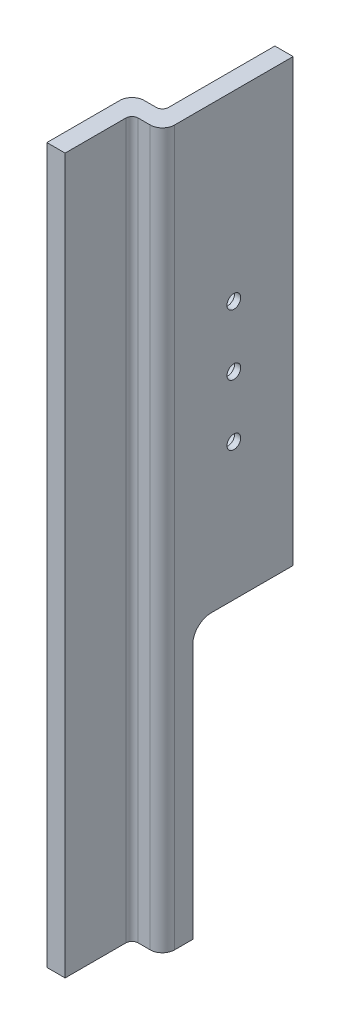
from build123d import *

# Parameters (mm, degrees)
SCHIZZO1_W                                           = 65
SCHIZZO1_H                                           = 235
ESTRUSIONE_ESTRUSIONE1_DEPTH                         = 16
SCHIZZO2_W                                           = 10
SCHIZZO2_H                                           = 37
TAGLIO_ESTRUSIONE1_DEPTH                             = 239.105018847
SCHIZZO3_W                                           = 33
SCHIZZO3_H                                           = 90
TAGLIO_ESTRUSIONE2_DEPTH                             = 239.432380351
SCHIZZO4_W                                           = 10
SCHIZZO4_H                                           = 22
TAGLIO_ESTRUSIONE3_DEPTH                             = 239.105018847
FORO_LAMATO_PER_VITE_M4_A_TESTA_ESAGONAL_D           = 4.5
FORO_LAMATO_PER_VITE_M4_A_TESTA_ESAGONAL_CBORE_D     = 8
FORO_LAMATO_PER_VITE_M4_A_TESTA_ESAGONAL_CBORE_DEPTH = 4
RACCORDO1_R                                          = 2
RACCORDO2_R                                          = 4
RACCORDO3_R                                          = 6


with BuildPart() as part:
    # Schizzo1 → Estrusione-Estrusione1 (new body)
    with BuildSketch(Plane(origin=(6, 0, 0), x_dir=(0, 0, -1), z_dir=(1, 0, 0))):
        with Locations((4.5, 117.5)):
            Rectangle(SCHIZZO1_W, SCHIZZO1_H)
    extrude(amount=-ESTRUSIONE_ESTRUSIONE1_DEPTH)

    # Schizzo2 → Taglio-Estrusione1 (cut, through all)
    with BuildSketch(Plane.XZ):
        with Locations((-5, -18.5)):
            Rectangle(SCHIZZO2_W, SCHIZZO2_H)
    extrude(amount=-TAGLIO_ESTRUSIONE1_DEPTH, mode=Mode.SUBTRACT)

    # Schizzo3 → Taglio-Estrusione2 (cut, through all)
    with BuildSketch(Plane(origin=(6, 0, 0), x_dir=(0, 0, -1), z_dir=(1, 0, 0))):
        with Locations((20.5, 45)):
            Rectangle(SCHIZZO3_W, SCHIZZO3_H)
    extrude(amount=-TAGLIO_ESTRUSIONE2_DEPTH, mode=Mode.SUBTRACT)

    # Schizzo4 → Taglio-Estrusione3 (cut, through all)
    with BuildSketch(Plane.XZ):
        with Locations((1, 17)):
            Rectangle(SCHIZZO4_W, SCHIZZO4_H)
    extrude(amount=-TAGLIO_ESTRUSIONE3_DEPTH, mode=Mode.SUBTRACT)

    # Foro lamato per Vite M4 a testa esagonale-1 (through all)
    with Locations(Plane.ZY):
        with Locations((-17.5, 175), (-17.5, 155), (-17.5, 135)):
            CounterBoreHole(FORO_LAMATO_PER_VITE_M4_A_TESTA_ESAGONAL_D / 2, FORO_LAMATO_PER_VITE_M4_A_TESTA_ESAGONAL_CBORE_D / 2, FORO_LAMATO_PER_VITE_M4_A_TESTA_ESAGONAL_CBORE_DEPTH)

    # Raccordo1
    raccordo1_edges = [part.edges().sort_by_distance(p)[0] for p in [
        (0, 117.5, 0),
        (-4, 117.5, 6),
    ]]
    fillet(raccordo1_edges, radius=RACCORDO1_R)

    # Raccordo2
    raccordo2_edges = [part.edges().sort_by_distance(p)[0] for p in [
        (-10, 117.5, 0),
        (6, 117.5, 6),
    ]]
    fillet(raccordo2_edges, radius=RACCORDO2_R)

    # Raccordo3
    raccordo3_edges = [part.edges().sort_by_distance(p)[0] for p in [
        (3, 90, -4),
    ]]
    fillet(raccordo3_edges, radius=RACCORDO3_R)


solid = part.part
